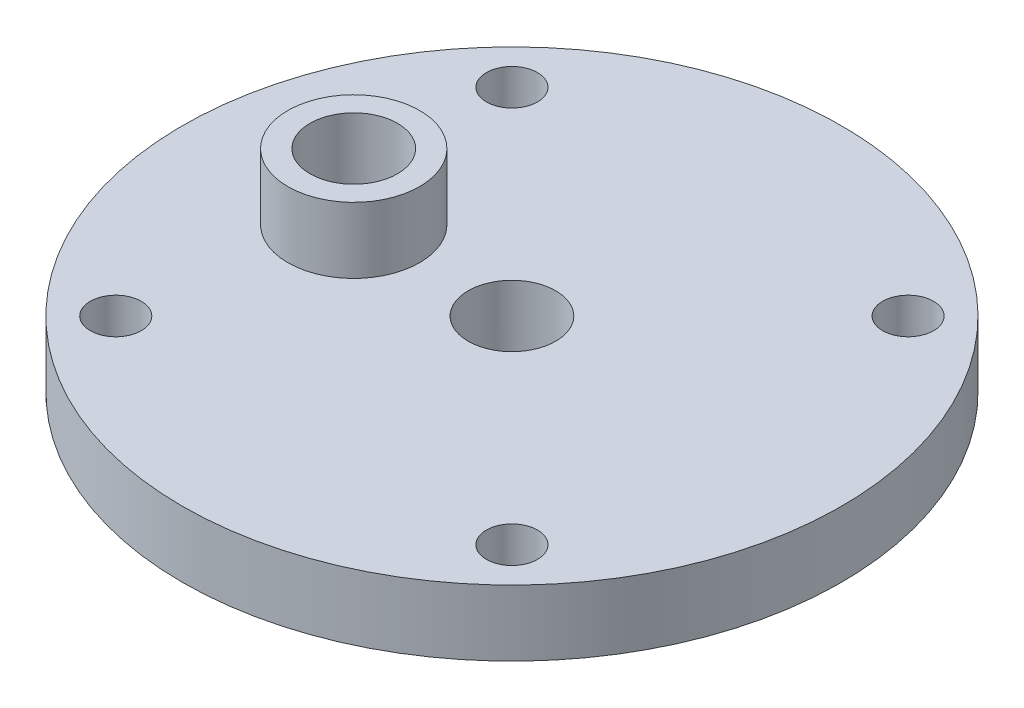
from build123d import *

# Parameters (mm, degrees)
PIPE_TAP_DRILL_FOR_1_8_TAP1_D     = 8.4328
PIPE_TAP_DRILL_FOR_1_8_TAP1_DEPTH = 25.4
PIPE_TAP_DRILL_FOR_1_8_TAP1_TIP   = 2.533468714
CIRPATTERN1_COUNT                 = 4
SKETCH5_R                         = 6.35
BOSS_EXTRUDE1_DEPTH               = 6.35
PIPE_TAP_DRILL_FOR_1_8_TAP2_D     = 8.4328
PIPE_TAP_DRILL_FOR_1_8_TAP2_DEPTH = 6.35
PIPE_TAP_DRILL_FOR_1_8_TAP2_TIP   = 2.533468714
F_1_8_0_125_DIAMETER_HOLE4_D      = 3.175
F_1_8_0_125_DIAMETER_HOLE4_DEPTH  = 14.2875
F_10_0_1935_DIAMETER_HOLE1_D      = 4.9149
CIRPATTERN2_COUNT                 = 4


with BuildPart() as part:
    # Sketch1 → Revolve1 (revolve)
    with BuildSketch(Plane.XY, mode=Mode.PRIVATE) as revolve1_sk:
        Polygon((0, 0), (-15.875, 0), (-15.875, 3.175), (-9.525, 3.175), (-9.525, 6.35), (-15.875, 6.35), (-15.875, 7.9375), (-31.75, 7.9375), (-31.75, 14.2875), (0, 14.2875), align=None)
    revolve(revolve1_sk.sketch.rotate(Axis((0, 14.2875, 0), (0, -1, 0)), 270), axis=Axis((0, 14.2875, 0), (0, -1, 0)))

    # Pipe Tap Drill for 1/8 Tap1
    with Locations(Plane.ZX.offset(14.2875)):
        with Locations((0, 0)):
            Hole(PIPE_TAP_DRILL_FOR_1_8_TAP1_D / 2, depth=PIPE_TAP_DRILL_FOR_1_8_TAP1_DEPTH)
            with Locations((0, 0, -(PIPE_TAP_DRILL_FOR_1_8_TAP1_DEPTH + PIPE_TAP_DRILL_FOR_1_8_TAP1_TIP / 2))):  # 118° drill point
                Cone(0, PIPE_TAP_DRILL_FOR_1_8_TAP1_D / 2, PIPE_TAP_DRILL_FOR_1_8_TAP1_TIP, mode=Mode.SUBTRACT)

    # Sketch3 → Cut-Revolve2 (revolve, cut)
    with BuildSketch(Plane(origin=(0, 0, 0), x_dir=(-1, 0, 0), z_dir=(0, 0, -1)), mode=Mode.PRIVATE) as cut_revolve2_sk:
        Polygon((-11.388289755, 5.3975), (-11.567894878, 5.217894878), (-4.900394878, -1.449605122), (-4.720789755, -1.27), align=None)
    cut_revolve2 = revolve(cut_revolve2_sk.sketch.rotate(Axis((11.567894878, 5.217894878, 0), (-0.7071067811865474, -0.7071067811865478, 0)), 89.45975418), axis=Axis((11.567894878, 5.217894878, 0), (-0.7071067811865474, -0.7071067811865478, 0)), mode=Mode.SUBTRACT)

    # CirPattern1: Cut-Revolve2 ×4 about axis
    cirpattern1_axis = Axis((0, 14.2875, 0), (0, 1, 0))
    for i in range(1, CIRPATTERN1_COUNT):
        add(cut_revolve2.rotate(cirpattern1_axis, i * 360 / CIRPATTERN1_COUNT), mode=Mode.SUBTRACT)

    # Sketch5 → Boss-Extrude1 (add)
    with BuildSketch(Plane(origin=(0, 14.2875, 0), x_dir=(1, 0, 0), z_dir=(0, 1, 0))):
        with Locations(Location((-15.24, 0, 0), (0, 0, 270))):
            Circle(SKETCH5_R)
    extrude(amount=BOSS_EXTRUDE1_DEPTH)

    # Pipe Tap Drill for 1/8 Tap2
    with Locations(Plane(origin=(-15.24, 20.6375, 0), x_dir=(0, 0, 1), z_dir=(0, 1, 0))):
        with Locations((0, 0)):
            Hole(PIPE_TAP_DRILL_FOR_1_8_TAP2_D / 2, depth=PIPE_TAP_DRILL_FOR_1_8_TAP2_DEPTH)
            with Locations((0, 0, -(PIPE_TAP_DRILL_FOR_1_8_TAP2_DEPTH + PIPE_TAP_DRILL_FOR_1_8_TAP2_TIP / 2))):  # 118° drill point
                Cone(0, PIPE_TAP_DRILL_FOR_1_8_TAP2_D / 2, PIPE_TAP_DRILL_FOR_1_8_TAP2_TIP, mode=Mode.SUBTRACT)

    # 1/8 (0.125) Diameter Hole4
    with Locations(Plane(origin=(-15.24, 20.6375, 0), x_dir=(0, 0, 1), z_dir=(0, 1, 0))):
        with Locations((0, 0)):
            Hole(F_1_8_0_125_DIAMETER_HOLE4_D / 2, depth=F_1_8_0_125_DIAMETER_HOLE4_DEPTH)

    # #10 (0.1935) Diameter Hole1 (through all)
    with Locations(Plane(origin=(19.083044257, 14.2875, -19.083044257), x_dir=(0, 0, 1), z_dir=(0, 1, 0))):
        with Locations((0, 0)):
            f_10_0_1935_diameter_hole1 = Hole(F_10_0_1935_DIAMETER_HOLE1_D / 2)

    # CirPattern2: #10 (0.1935) Diameter Hole1 ×4 about axis
    cirpattern2_axis = Axis((0, 0, 0), (0, 1, 0))
    for i in range(1, CIRPATTERN2_COUNT):
        add(f_10_0_1935_diameter_hole1.rotate(cirpattern2_axis, i * 360 / CIRPATTERN2_COUNT), mode=Mode.SUBTRACT)


solid = part.part
